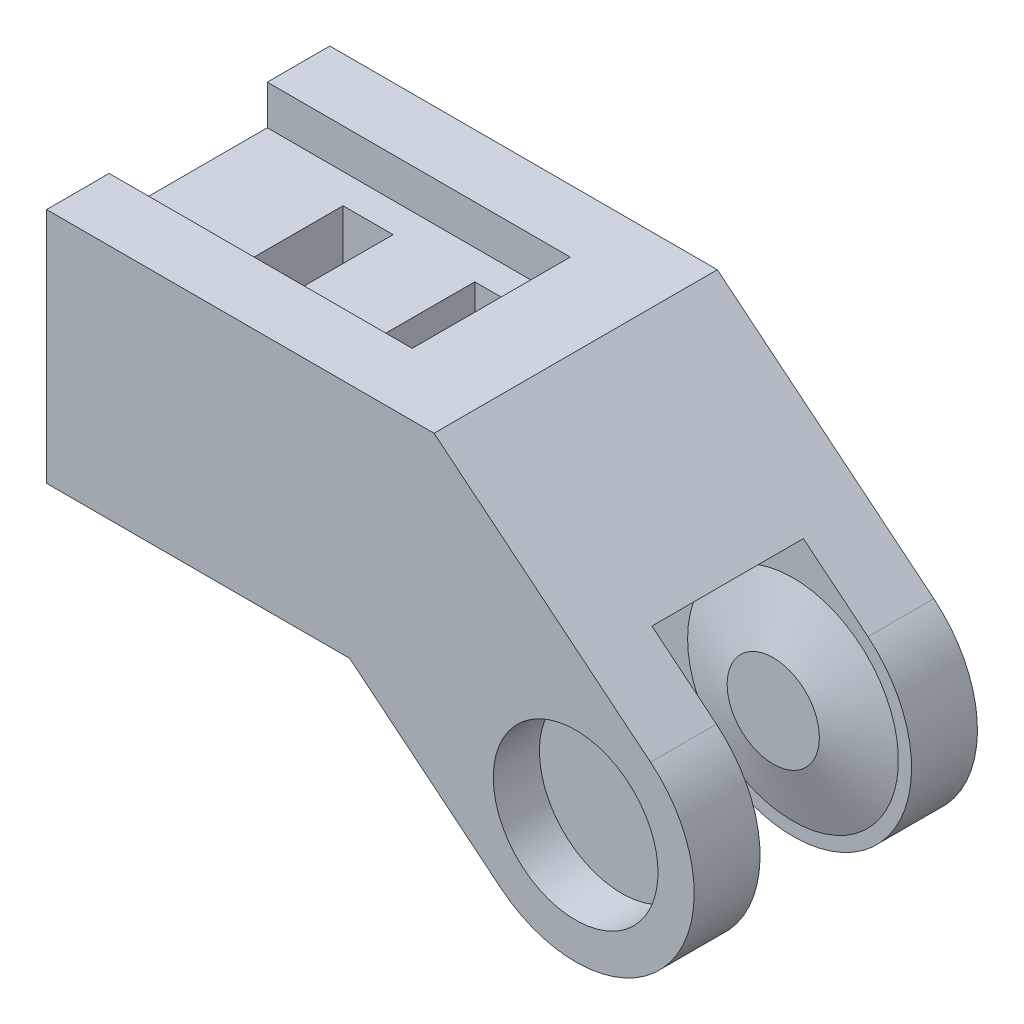
from build123d import *

# Parameters (mm, degrees)
BOSS_EXTRUDE1_DEPTH = 5
SKETCH8_R           = 3.5
BOSS_EXTRUDE5_DEPTH = 1.5
SKETCH10_R          = 8
BOSS_EXTRUDE7_DEPTH = 5.75
SKETCH15_R          = 2.8
CUT_EXTRUDE7_DEPTH  = 10
NUT_CUT_START       = -1.5
SKETCH6_W           = 8.4
SKETCH6_H           = 8.4
NUT_CUT_DEPTH       = 46.182751545
SKETCH16_W          = 12
SKETCH16_H          = 3
CUT_EXTRUDE8_DEPTH  = 23
SKETCH17_R          = 2.35
CUT_EXTRUDE9_DEPTH  = 28
CUT_EXTRUDE10_START = 1.5
SKETCH19_R          = 6.25
CUT_EXTRUDE10_DEPTH = 46.182751545
CUT_EXTRUDE11_START = -8
CUT_EXTRUDE11_DEPTH = 3.8
LPATTERN1_COUNT     = 2
LPATTERN1_PITCH     = 10
SKETCH22_R          = 3.051848234
BOSS_EXTRUDE8_DEPTH = 0.65
SKETCH23_R          = 3.919040969
BOSS_EXTRUDE9_DEPTH = 0.65


with BuildPart() as part:
    # Sketch1 → Boss-Extrude1 (new body)
    with BuildSketch(Plane.XY):
        with BuildLine():
            Line((-40.155138696, -0.836255417), (-17.155138696, -0.836255417))
            Line((-17.155138696, -0.836255417), (-5.68921993, -10.190248634))
            ThreePointArc((-5.68921993, -10.190248634), (6.973720426, -8.905748138), (5.68921993, 3.757192218))
            Line((5.68921993, 3.757192218), (-10.744236538, 17.163744583))
            Line((-10.744236538, 17.163744583), (-40.155138696, 17.163744583))
            Line((-40.155138696, 17.163744583), (-40.155138696, -0.836255417))
        make_face()
    extrude(amount=BOSS_EXTRUDE1_DEPTH)

    # Sketch8 → Boss-Extrude5 (add)
    with BuildSketch(Plane.XY.offset(5)):
        with Locations((0, -3.216528208)):
            Circle(SKETCH8_R)
    extrude(amount=BOSS_EXTRUDE5_DEPTH)

    # Sketch10 → section 0 of loft4
    with BuildSketch(Plane.XY.offset(5), mode=Mode.PRIVATE) as loft4_s0:
        with Locations((0, -3.216528208)):
            Circle(SKETCH10_R)
    # loft up to a face of the part (loft4)
    loft([loft4_s0.sketch, part.faces().sort_by_distance((0, -3.216528208, 6.5))[0]])

    # Sketch14 → Boss-Extrude7 (add)
    with BuildSketch(Plane.XY.offset(5)):
        with BuildLine():
            Line((-40.155138696, -0.836255417), (-40.155138696, 17.163744583))
            Line((-40.155138696, 17.163744583), (-10.744236538, 17.163744583))
            Line((-10.744236538, 17.163744583), (0.78858875, 7.75516846))
            ThreePointArc((0.78858875, 7.75516846), (-8.523436076, 3.736962818), (-10.589851111, -6.192272392))
            Line((-10.589851111, -6.192272392), (-17.155138696, -0.836255417))
            Line((-17.155138696, -0.836255417), (-40.155138696, -0.836255417))
        make_face()
    extrude(amount=BOSS_EXTRUDE7_DEPTH)

    # Sketch15 → Cut-Extrude7 (cut)
    with BuildSketch(Plane(origin=(0, 0, 0), x_dir=(-1, 0, 0), z_dir=(0, 0, -1))):
        with Locations((0, -3.216528208)):
            Circle(SKETCH15_R)
    extrude(amount=-CUT_EXTRUDE7_DEPTH, mode=Mode.SUBTRACT)

    # Mirror1: part across plane


with BuildPart() as part_1:
    add(part.part)
    add(part.part.mirror(Plane(origin=(0, -3.216528208, 10.75), x_dir=(1, 0, 0), z_dir=(0, 0, 1))))

    # Sketch6 → nut-cut (cut, through all)
    with BuildSketch(Plane.XY.offset(5).offset(NUT_CUT_START)):
        with Locations((0, -3.216528208)):
            Rectangle(SKETCH6_W, SKETCH6_H)
    extrude(amount=-NUT_CUT_DEPTH, mode=Mode.SUBTRACT)

    # Sketch16 → Cut-Extrude8 (cut)
    with BuildSketch(Plane.ZY.offset(40.155138696)):
        with Locations((10.75, 0.663744583)):
            Rectangle(SKETCH16_W, SKETCH16_H)
        with Locations((10.75, 15.663744583)):
            Rectangle(SKETCH16_W, SKETCH16_H)
    extrude(amount=-CUT_EXTRUDE8_DEPTH, mode=Mode.SUBTRACT)

    # Sketch17 → Cut-Extrude9 (cut)
    with BuildSketch(Plane.ZY.offset(40.155138696)):
        with Locations((10.75, 8.163744583)):
            Circle(SKETCH17_R)
    extrude(amount=-CUT_EXTRUDE9_DEPTH, mode=Mode.SUBTRACT)

    # Sketch19 → Cut-Extrude10 (cut, through all)
    with BuildSketch(Plane.XY.offset(16.5).offset(CUT_EXTRUDE10_START)):
        with Locations(Location((0, -3.216528208, 0), (0, 0, 180))):
            Circle(SKETCH19_R)
    extrude(amount=CUT_EXTRUDE10_DEPTH, mode=Mode.SUBTRACT)

    # Sketch20 → Cut-Extrude11 (cut)
    with BuildSketch(Plane.ZY.offset(40.155138696).offset(CUT_EXTRUDE11_START)):
        Polygon((7, 14.163744583), (14.5, 14.163744583), (14.5, 5.998681073), (10.75, 3.833617564), (7, 5.998681073), align=None)
    cut_extrude11 = extrude(amount=-CUT_EXTRUDE11_DEPTH, mode=Mode.SUBTRACT)

    # LPattern1: Cut-Extrude11 ×2
    with Locations(*[(i * LPATTERN1_PITCH, 0, 0) for i in range(1, LPATTERN1_COUNT)]):
        add(cut_extrude11, mode=Mode.SUBTRACT)

    # Sketch22 → Boss-Extrude8 (add)
    with BuildSketch(Plane(origin=(0, 0, 6.5), x_dir=(-1, 0, 0), z_dir=(0, 0, -1))):
        with Locations((0, -3.216528208)):
            Circle(SKETCH22_R)
    extrude(amount=BOSS_EXTRUDE8_DEPTH)

    # Sketch23 → Boss-Extrude9 (add)
    with BuildSketch(Plane.XY.offset(18)):
        with Locations((0, -3.216528208)):
            Circle(SKETCH23_R)
    extrude(amount=-BOSS_EXTRUDE9_DEPTH)


solid = part_1.part
